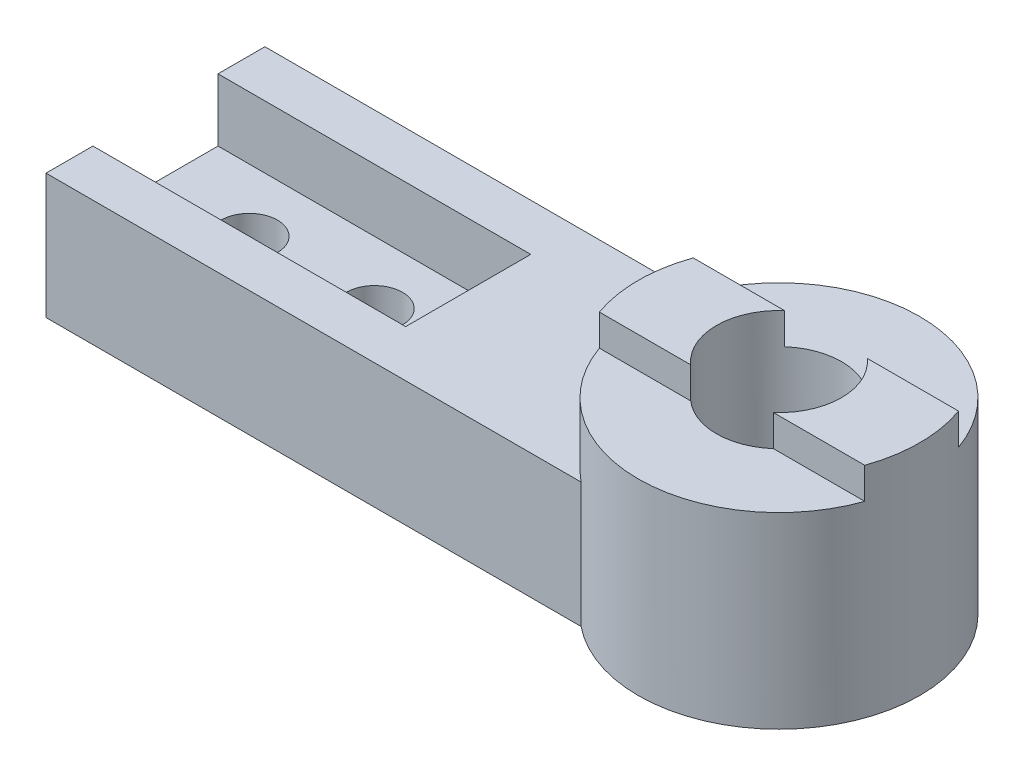
from build123d import *

# Parameters (mm, degrees)
IZIM1_R                     = 22.5
IZIM1_R_2                   = 10
Y_KSEKLIK_EKSTR_ZYON1_DEPTH = 30
Y_KSEKLIK_EKSTR_ZYON2_DEPTH = 5
Y_KSEKLIK_EKSTR_ZYON3_DEPTH = 20
IZIM4_W                     = 50
IZIM4_H                     = 20
KES_EKSTR_ZYON1_DEPTH       = 10
IZIM5_R                     = 4.5
KES_EKSTR_ZYON2_DEPTH       = 10


with BuildPart() as part:
    # Çizim1 → Yükseklik-Ekstrüzyon1 (new body)
    with BuildSketch(Plane(origin=(0, 0, 0), x_dir=(1, 0, 0), z_dir=(0, 1, 0))):
        with Locations(Location((0, 0, 0), (0, 0, 270))):
            Circle(IZIM1_R)
        with Locations(Location((0, 0, 0), (0, 0, 270))):
            Circle(IZIM1_R_2, mode=Mode.SUBTRACT)
    extrude(amount=Y_KSEKLIK_EKSTR_ZYON1_DEPTH)

    # Çizim2 → Yükseklik-Ekstrüzyon2 (add)
    with BuildSketch(Plane(origin=(0, 30, 0), x_dir=(1, 0, 0), z_dir=(0, 1, 0))):
        with BuildLine():
            Line((-6.614378278, 7.5), (-21.213203436, 7.5))
            ThreePointArc((-21.213203436, 7.5), (-22.5, 0), (-21.213203436, -7.5))
            Line((-21.213203436, -7.5), (-6.614378278, -7.5))
            ThreePointArc((-6.614378278, -7.5), (-10, 0), (-6.614378278, 7.5))
        make_face()
        with BuildLine():
            Line((21.213203436, 7.5), (6.614378278, 7.5))
            ThreePointArc((6.614378278, 7.5), (10, 0), (6.614378278, -7.5))
            Line((6.614378278, -7.5), (21.213203436, -7.5))
            ThreePointArc((21.213203436, -7.5), (22.5, 0), (21.213203436, 7.5))
        make_face()
    extrude(amount=Y_KSEKLIK_EKSTR_ZYON2_DEPTH)

    # Çizim3 → Yükseklik-Ekstrüzyon3 (add)
    with BuildSketch(Plane(origin=(0, 0, 0), x_dir=(1, 0, 0), z_dir=(0, 1, 0))):
        with BuildLine():
            Line((-14.142135624, -17.5), (-99.683227017, -17.5))
            Line((-99.683227017, -17.5), (-99.683227017, 17.5))
            Line((-99.683227017, 17.5), (-14.142135624, 17.5))
            ThreePointArc((-14.142135624, 17.5), (-18.371173071, 12.990381057), (-21.213203436, 7.5))
            ThreePointArc((-21.213203436, 7.5), (-22.5, 0), (-21.213203436, -7.5))
            ThreePointArc((-21.213203436, -7.5), (-18.371173071, -12.990381057), (-14.142135624, -17.5))
        make_face()
    extrude(amount=Y_KSEKLIK_EKSTR_ZYON3_DEPTH)

    # Çizim4 → Kes-Ekstrüzyon1 (cut)
    with BuildSketch(Plane(origin=(0, 20, 0), x_dir=(1, 0, 0), z_dir=(0, 1, 0))):
        with Locations((-74.683227017, 0)):
            Rectangle(IZIM4_W, IZIM4_H)
    extrude(amount=-KES_EKSTR_ZYON1_DEPTH, mode=Mode.SUBTRACT)

    # Çizim5 → Kes-Ekstrüzyon2 (cut)
    with BuildSketch(Plane(origin=(0, 10, 0), x_dir=(1, 0, 0), z_dir=(0, 1, 0))):
        with Locations(Location((-84.683227017, 0, 0), (0, 0, 270))):
            Circle(IZIM5_R)
        with Locations(Location((-64.683227017, 0, 0), (0, 0, 270))):
            Circle(IZIM5_R)
    extrude(amount=-KES_EKSTR_ZYON2_DEPTH, mode=Mode.SUBTRACT)


solid = part.part
